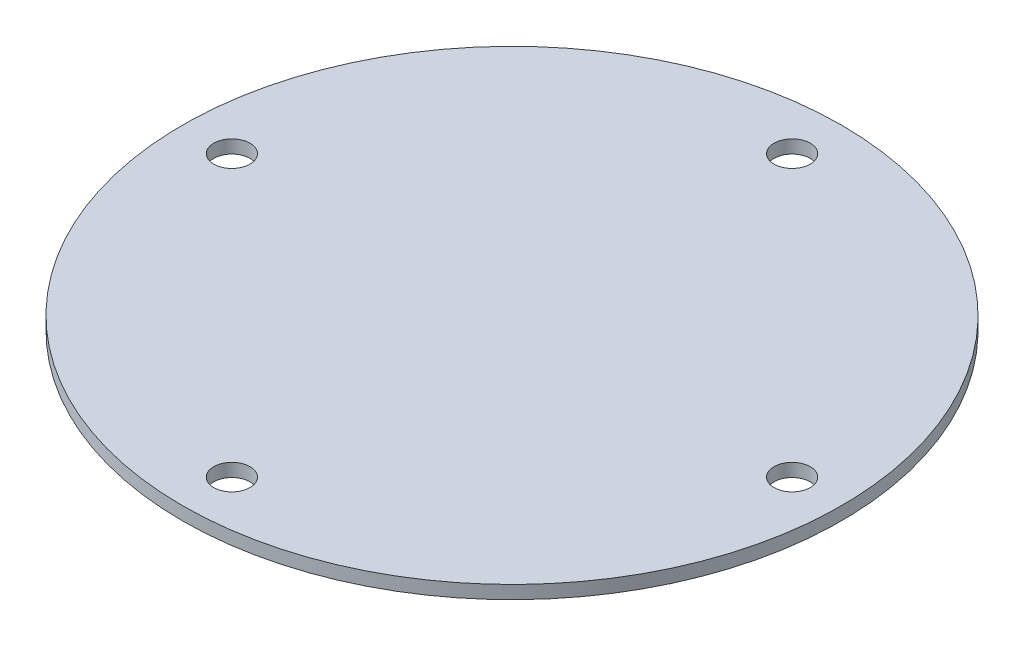
from build123d import *

# Parameters (mm, degrees)
SKETCH1_R           = 50
SKETCH1_R_2         = 2.75
BOSS_EXTRUDE1_DEPTH = 2


with BuildPart() as part:
    # Sketch1 → Boss-Extrude1 (new body)
    with BuildSketch(Plane(origin=(0, 0, 0), x_dir=(1, 0, 0), z_dir=(0, 1, 0))):
        with Locations(Location((0, 0, 0), (0, 0, 270))):
            Circle(SKETCH1_R)
        with Locations(Location((0, 42.5, 0), (0, 0, 270))):
            Circle(SKETCH1_R_2, mode=Mode.SUBTRACT)
        with Locations(Location((42.5, 0, 0), (0, 0, 270))):
            Circle(SKETCH1_R_2, mode=Mode.SUBTRACT)
        with Locations(Location((0, -42.5, 0), (0, 0, 270))):
            Circle(SKETCH1_R_2, mode=Mode.SUBTRACT)
        with Locations(Location((-42.5, 0, 0), (0, 0, 270))):
            Circle(SKETCH1_R_2, mode=Mode.SUBTRACT)
    extrude(amount=BOSS_EXTRUDE1_DEPTH)


solid = part.part
